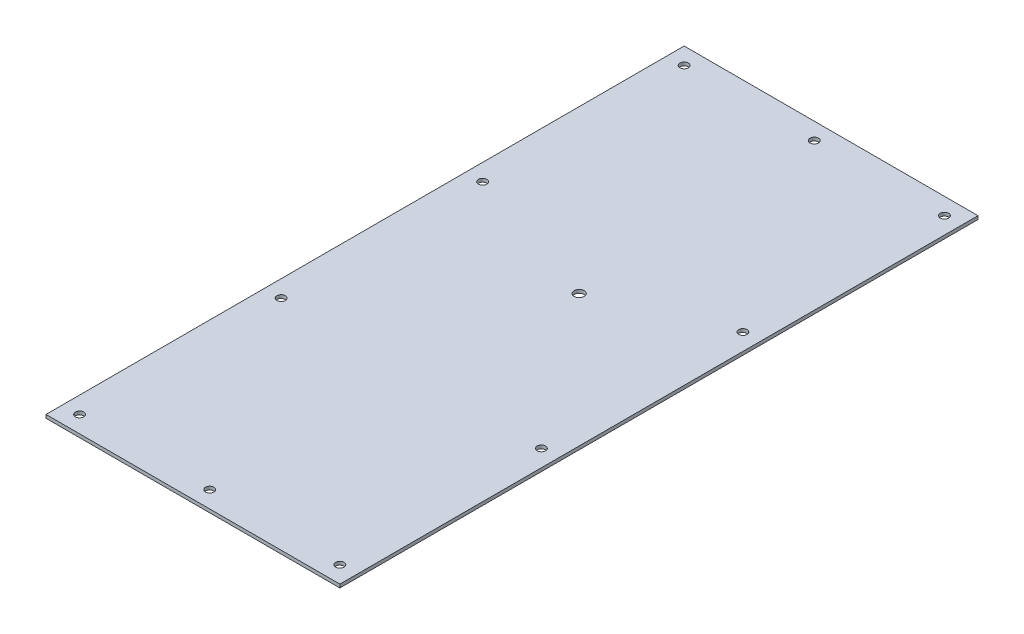
from build123d import *

# Parameters (mm, degrees)
SKICA1_W                 = 175
SKICA1_H                 = 380
SKICA1_R                 = 2.5
P_IDAT_VYSUNUT_M1_DEPTH  = 2
SKICA2_R                 = 3
ODEBRAT_VYSUNUT_M1_DEPTH = 2


with BuildPart() as part:
    # Skica1 → Přidat vysunutím1 (new body)
    with BuildSketch(Plane(origin=(0, 0, 0), x_dir=(1, 0, 0), z_dir=(0, 1, 0))):
        Rectangle(SKICA1_W, SKICA1_H)
        with Locations(Location((-77.5, 180, 0), (0, 0, 270))):
            Circle(SKICA1_R, mode=Mode.SUBTRACT)
        with Locations(Location((0, 180, 0), (0, 0, 270))):
            Circle(SKICA1_R, mode=Mode.SUBTRACT)
        with Locations(Location((77.5, 180, 0), (0, 0, 270))):
            Circle(SKICA1_R, mode=Mode.SUBTRACT)
        with Locations(Location((77.5, 60, 0), (0, 0, 270))):
            Circle(SKICA1_R, mode=Mode.SUBTRACT)
        with Locations(Location((77.5, -60, 0), (0, 0, 270))):
            Circle(SKICA1_R, mode=Mode.SUBTRACT)
        with Locations(Location((0, -180, 0), (0, 0, 270))):
            Circle(SKICA1_R, mode=Mode.SUBTRACT)
        with Locations(Location((77.5, -180, 0), (0, 0, 270))):
            Circle(SKICA1_R, mode=Mode.SUBTRACT)
        with Locations(Location((-77.5, 60, 0), (0, 0, 270))):
            Circle(SKICA1_R, mode=Mode.SUBTRACT)
        with Locations(Location((-77.5, -60, 0), (0, 0, 270))):
            Circle(SKICA1_R, mode=Mode.SUBTRACT)
        with Locations(Location((-77.5, -180, 0), (0, 0, 270))):
            Circle(SKICA1_R, mode=Mode.SUBTRACT)
    extrude(amount=P_IDAT_VYSUNUT_M1_DEPTH)

    # Skica2 → Odebrat vysunutím1 (cut)
    with BuildSketch(Plane(origin=(0, 2, 0), x_dir=(1, 0, 0), z_dir=(0, 1, 0))):
        with Locations(Location((8.896944134, 31.106394631, 0), (0, 0, 270))):
            Circle(SKICA2_R)
    extrude(amount=-ODEBRAT_VYSUNUT_M1_DEPTH, mode=Mode.SUBTRACT)


solid = part.part
